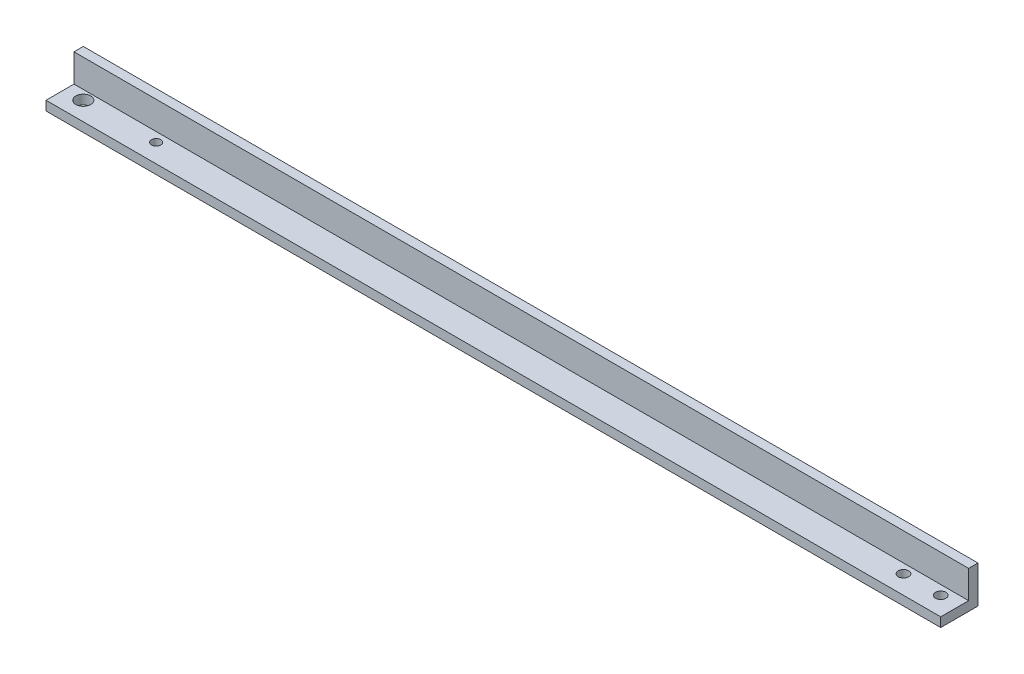
from build123d import *

# Parameters (mm, degrees)
BOSS_EXTRUDE1_DEPTH = 609.6
SKETCH2_R           = 5.08
SKETCH2_R_2         = 3.175
SKETCH2_R_3         = 3.556
CUT_EXTRUDE1_DEPTH  = 914.4


with BuildPart() as part:
    # Sketch1 → Boss-Extrude1 (new body)
    with BuildSketch(Plane(origin=(0, 0, 0), x_dir=(0, 0, -1), z_dir=(1, 0, 0))):
        Polygon((0, 0), (0, 19.05), (6.35, 19.05), (6.35, -6.35), (-19.05, -6.35), (-19.05, 0), align=None)
    extrude(amount=BOSS_EXTRUDE1_DEPTH)

    # Sketch2 → Cut-Extrude1 (cut)
    with BuildSketch(Plane.XZ.offset(6.35)):
        with Locations(Location((12.7, 6.35, 0), (0, 0, 270))):
            Circle(SKETCH2_R)
        with Locations(Location((62.357, 6.35, 0), (0, 0, 270))):
            Circle(SKETCH2_R_2)
        with Locations(Location((596.9, 6.35, 0), (0, 0, 270))):
            Circle(SKETCH2_R_3)
        with Locations(Location((571.5, 6.35, 0), (0, 0, 270))):
            Circle(SKETCH2_R_3)
    extrude(amount=-CUT_EXTRUDE1_DEPTH, mode=Mode.SUBTRACT)


solid = part.part
